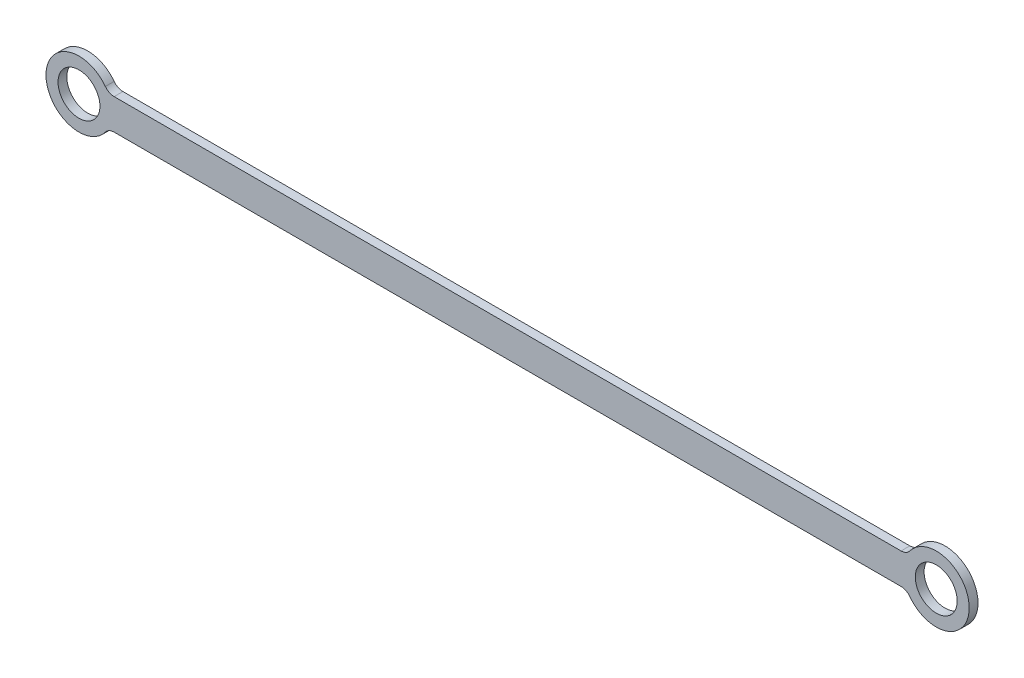
from build123d import *

# Parameters (mm, degrees)
SKETCH_2_R      = 9.53
EXTRUDE_2_DEPTH = 4


with BuildPart() as part:
    # 草图2 → 凸台-拉伸2 (new body)
    with BuildSketch(Plane.XY):
        with BuildLine():
            Line((-179, 7), (179, 7))
            ThreePointArc((179, 7), (181.236067978, 7.527864045), (183, 9))
            ThreePointArc((183, 9), (210, 0), (183, -9))
            ThreePointArc((183, -9), (181.236067978, -7.527864045), (179, -7))
            Line((179, -7), (-179, -7))
            ThreePointArc((-179, -7), (-181.236067977, -7.527864045), (-183, -9))
            ThreePointArc((-183, -9), (-210, 0), (-183, 9))
            ThreePointArc((-183, 9), (-181.236067977, 7.527864045), (-179, 7))
        make_face()
        with Locations((-195, 0)):
            Circle(SKETCH_2_R, mode=Mode.SUBTRACT)
        with Locations((195, 0)):
            Circle(SKETCH_2_R, mode=Mode.SUBTRACT)
    extrude(amount=EXTRUDE_2_DEPTH)


solid = part.part
